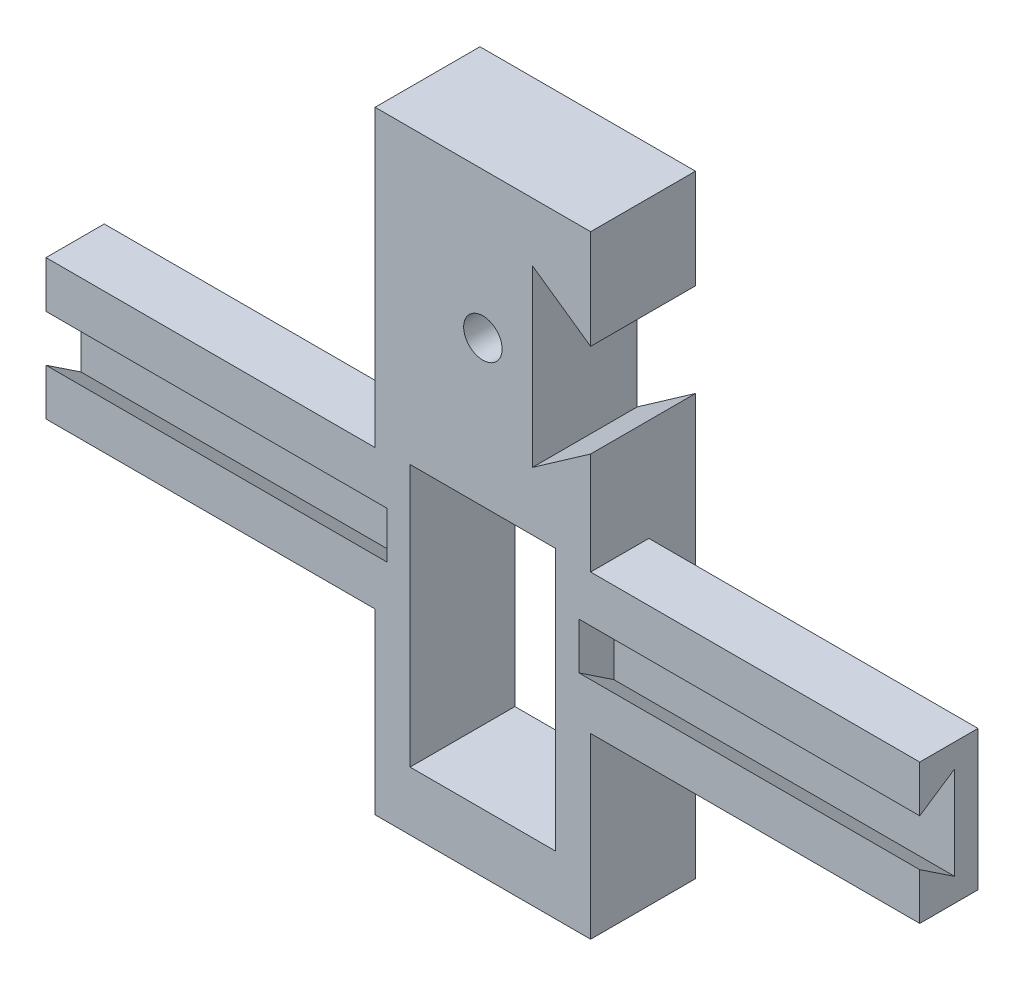
from build123d import *

# Parameters (mm, degrees)
SKETCH_1_W           = 12.5
SKETCH_1_H           = 22.5
EXTRUDE_1_DEPTH      = 5
CUT_EXTRUDE_2_DEPTH  = 29.25
CUT_EXTRUDE_4_DEPTH  = 29.25
SKETCH_1_9_R         = 1.5
SKETCH_1_9_W         = 3
SKETCH_1_9_H         = 4.5
EXTRUDE_2_DEPTH      = 4
EXTRUDE_7_DEPTH      = 5
EXTRUDE_7_DEPTH_BACK = 4
SKETCH_1_11_W        = 18.5
SKETCH_1_11_H        = 20
CUT_EXTRUDE_5_DEPTH  = 53.961684263
CUT_EXTRUDE_START    = -9
CUT_EXTRUDE_7_DEPTH  = 9
CUT_EXTRUDE_8_DEPTH  = 11
CUT_EXTRUDE_START_2  = -2
SKETCH_10_R          = 1.5
CUT_EXTRUDE_9_DEPTH  = 2


with BuildPart() as part:
    # 草图1 → 凸台-拉伸1 (new body)
    with BuildSketch(Plane.XY):
        Polygon((-9.25, 11), (-37.5, 11), (-37.5, -1), (-9.25, -1), (-9.25, -16.3), (9.25, -16.3), (9.25, -1), (37.5, -1), (37.5, 11), (9.25, 11), (9.25, 16.3), (-9.25, 16.3), align=None)
        Rectangle(SKETCH_1_W, SKETCH_1_H, mode=Mode.SUBTRACT)
    extrude(amount=EXTRUDE_1_DEPTH)

    # 草图2 → 切除-拉伸2 (cut)
    with BuildSketch(Plane.ZY.offset(37.5)):
        Polygon((5, 7), (5, 3), (2, 1), (2, 9), align=None)
    extrude(amount=-CUT_EXTRUDE_2_DEPTH, mode=Mode.SUBTRACT)

    # 草图3 → 切除-拉伸4 (cut)
    with BuildSketch(Plane(origin=(37.5, 0, 0), x_dir=(0, 0, -1), z_dir=(1, 0, 0))):
        Polygon((-5, 7), (-5, 3), (-2, 1), (-2, 9), align=None)
    extrude(amount=-CUT_EXTRUDE_4_DEPTH, mode=Mode.SUBTRACT)

    # 草图1<9> → 凸台-拉伸2 (add)
    # profile 1 of 8: a face of its own
    with BuildSketch(Plane.XY):
        Polygon((-9.25, 11), (-6.25, 11), (-6.25, 11.25), (0, 11.25), (6.25, 11.25), (6.25, 11), (9.25, 11), (9.25, 16.3), (-9.25, 16.3), align=None)
        with Locations((0, 13.8)):
            Circle(SKETCH_1_9_R, mode=Mode.SUBTRACT)
    # profile 2 of 8: a face of its own
    with BuildSketch(Plane.XY):
        with Locations((-7.75, 8.75)):
            Rectangle(SKETCH_1_9_W, SKETCH_1_9_H)
    # profile 3 of 8: a face of its own
    with BuildSketch(Plane.XY):
        with Locations((7.75, 8.75)):
            Rectangle(SKETCH_1_9_W, SKETCH_1_9_H)
    # profile 4 of 8: a face of its own
    with BuildSketch(Plane.XY):
        Polygon((6.25, 5), (6.25, 3.5), (9.25, 3.5), (9.25, 6.5), (6.25, 6.5), align=None)
    # profile 5 of 8: a face of its own
    with BuildSketch(Plane.XY):
        with Locations((7.75, 1.25)):
            Rectangle(SKETCH_1_9_W, SKETCH_1_9_H)
    # profile 6 of 8: a face of its own
    with BuildSketch(Plane.XY):
        Polygon((6.25, -11.25), (-6.25, -11.25), (-6.25, -1), (-9.25, -1), (-9.25, -16.3), (9.25, -16.3), (9.25, -1), (6.25, -1), align=None)
        with Locations((0, -13.8)):
            Circle(SKETCH_1_9_R, mode=Mode.SUBTRACT)
    # profile 7 of 8: a face of its own
    with BuildSketch(Plane.XY):
        with Locations((-7.75, 1.25)):
            Rectangle(SKETCH_1_9_W, SKETCH_1_9_H)
    # profile 8 of 8: a face of its own
    with BuildSketch(Plane.XY):
        Polygon((-9.25, 3.5), (-6.25, 3.5), (-6.25, 4.999999998), (-6.25, 6.5), (-9.25, 6.5), align=None)
    extrude(amount=-EXTRUDE_2_DEPTH)

    # 草图1<11> → 凸台-拉伸7 (add, two sides: drawn at the far end of the back side and taken through both)
    with BuildSketch(Plane.XY.offset(-EXTRUDE_7_DEPTH_BACK)):
        with Locations((0, 26.3)):
            Rectangle(SKETCH_1_11_W, SKETCH_1_11_H)
    extrude(amount=EXTRUDE_7_DEPTH + EXTRUDE_7_DEPTH_BACK)

    # 草图6 → 切除-拉伸5 (cut, through all)
    with BuildSketch(Plane.XY.offset(5)):
        Polygon((9.25, 23.775), (9.25, 27.775), (4.25, 31.275), (4.25, 23.775), align=None)
        Polygon((9.25, 19.775), (9.25, 23.775), (4.25, 23.775), (4.25, 16.275), align=None)
    extrude(amount=-CUT_EXTRUDE_5_DEPTH, mode=Mode.SUBTRACT)

    # 草图6<4> → 切除-拉伸7 (cut)
    with BuildSketch(Plane.XY.offset(5).offset(CUT_EXTRUDE_START)):
        with BuildLine():
            ThreePointArc((-1.65, 23.775), (0, 22.125), (1.65, 23.775))
            Line((1.65, 23.775), (-1.65, 23.775))
        make_face()
        with BuildLine():
            Line((-1.65, 23.775), (1.65, 23.775))
            ThreePointArc((1.65, 23.775), (0, 25.425), (-1.65, 23.775))
        make_face()
        with BuildLine():
            ThreePointArc((-1.65, 23.775), (0, 22.125), (1.65, 23.775))
            Line((1.65, 23.775), (-1.65, 23.775))
        make_face()
        with BuildLine():
            Line((-1.65, 23.775), (1.65, 23.775))
            ThreePointArc((1.65, 23.775), (0, 25.425), (-1.65, 23.775))
        make_face()
    extrude(amount=CUT_EXTRUDE_7_DEPTH, mode=Mode.SUBTRACT)

    # 草图9 → 切除-拉伸8 (cut)
    with BuildSketch(Plane.ZY.offset(9.25)):
        with BuildLine():
            ThreePointArc((2.15, 23.77), (0.5, 25.42), (-1.15, 23.77))
            Line((-1.15, 23.77), (2.15, 23.77))
        make_face()
        with BuildLine():
            Line((2.15, 23.77), (-1.15, 23.77))
            ThreePointArc((-1.15, 23.77), (0.5, 22.12), (2.15, 23.77))
        make_face()
        with BuildLine():
            ThreePointArc((2.15, 23.77), (0.5, 25.42), (-1.15, 23.77))
            Line((-1.15, 23.77), (2.15, 23.77))
        make_face()
        with BuildLine():
            Line((2.15, 23.77), (-1.15, 23.77))
            ThreePointArc((-1.15, 23.77), (0.5, 22.12), (2.15, 23.77))
        make_face()
    extrude(amount=-CUT_EXTRUDE_8_DEPTH, mode=Mode.SUBTRACT)

    # 草图10 → 切除-拉伸9 (cut)
    with BuildSketch(Plane(origin=(0, 0, 0), x_dir=(-1, 0, 0), z_dir=(0, 0, -1)).offset(CUT_EXTRUDE_START_2)):
        with Locations(Location((0, 13.8, 0), (0, 0, 180))):
            Circle(SKETCH_10_R)
        with Locations(Location((0, -13.8, 0), (0, 0, 180))):
            Circle(SKETCH_10_R)
    extrude(amount=CUT_EXTRUDE_9_DEPTH, mode=Mode.SUBTRACT)


solid = part.part
